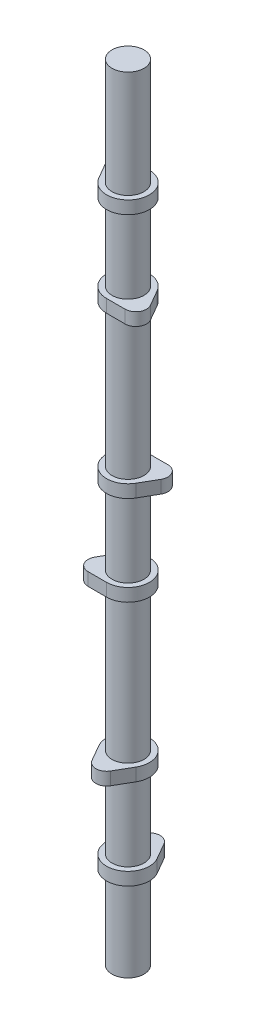
from build123d import *

# Parameters (mm, degrees)
BOSS_EXTRUDE1_DEPTH   = 7.62
LPATTERN1_COUNT       = 2
LPATTERN1_PITCH       = 53.34
BODY_MOVE_COPY1_ANGLE = 180
LPATTERN2_COUNT       = 3
LPATTERN2_PITCH       = 146.05
BODY_MOVE_COPY2_ANGLE = 120
BODY_MOVE_COPY3_ANGLE = 120
BOSS_EXTRUDE2_START   = -49.53
SKETCH2_R             = 9.5
BOSS_EXTRUDE2_DEPTH   = 466.09


with BuildPart() as part:
    # Sketch1 → Boss-Extrude1 (new body)
    with BuildSketch(Plane(origin=(0, 0, 0), x_dir=(1, 0, 0), z_dir=(0, 1, 0))):
        with BuildLine():
            Line((-5.499261314, 15.875), (-10.998522628, 6.35))
            ThreePointArc((-10.998522628, 6.35), (0, -12.7), (10.998522628, 6.35))
            Line((10.998522628, 6.35), (5.499261314, 15.875))
            ThreePointArc((5.499261314, 15.875), (0, 19.05), (-5.499261314, 15.875))
        make_face()
    extrude(amount=BOSS_EXTRUDE1_DEPTH)


with BuildPart() as lpattern1_1:
    # LPattern1: pattern copy
    add(part.part.moved(Location(Vector(0, 1, 0) * (1 * LPATTERN1_PITCH))))


with BuildPart() as lpattern1_1_1:
    # Body-Move/Copy1: moved
    add(lpattern1_1.part.rotate(Axis((0, 0, 0), (0, 1, 0)), BODY_MOVE_COPY1_ANGLE))


with BuildPart() as lpattern2_1:
    # LPattern2: pattern copy
    add(part.part.moved(Location(Vector(0, 1, 0) * (1 * LPATTERN2_PITCH))))


with BuildPart() as lpattern2_2:
    # LPattern2: pattern copy
    add(part.part.moved(Location(Vector(0, 1, 0) * (2 * LPATTERN2_PITCH))))


with BuildPart() as lpattern2_3:
    # LPattern2: pattern copy
    add(lpattern1_1_1.part.moved(Location(Vector(0, 1, 0) * (1 * LPATTERN2_PITCH))))


with BuildPart() as lpattern2_4:
    # LPattern2: pattern copy
    add(lpattern1_1_1.part.moved(Location(Vector(0, 1, 0) * (2 * LPATTERN2_PITCH))))


with BuildPart() as lpattern2_1_1:
    # Body-Move/Copy2: moved
    add(lpattern2_1.part.rotate(Axis((0, 0, 0), (0, 1, 0)), BODY_MOVE_COPY2_ANGLE))


with BuildPart() as lpattern2_3_1:
    # Body-Move/Copy2: moved
    add(lpattern2_3.part.rotate(Axis((0, 0, 0), (0, 1, 0)), BODY_MOVE_COPY2_ANGLE))


with BuildPart() as lpattern2_2_1:
    # Body-Move/Copy3: moved
    add(lpattern2_2.part.rotate(Axis((0, 0, 0), (0, -1, 0)), BODY_MOVE_COPY3_ANGLE))


with BuildPart() as lpattern2_4_1:
    # Body-Move/Copy3: moved
    add(lpattern2_4.part.rotate(Axis((0, 0, 0), (0, -1, 0)), BODY_MOVE_COPY3_ANGLE))


with BuildPart() as part_1:
    add(part.part)

    add(lpattern1_1_1.part)  # Boss-Extrude2 merges LPattern1_1

    add(lpattern2_1_1.part)  # Boss-Extrude2 merges LPattern2_1

    add(lpattern2_2_1.part)  # Boss-Extrude2 merges LPattern2_2

    add(lpattern2_3_1.part)  # Boss-Extrude2 merges LPattern2_3

    add(lpattern2_4_1.part)  # Boss-Extrude2 merges LPattern2_4
    # Sketch2 → Boss-Extrude2 (add)
    with BuildSketch(Plane(origin=(0, 0, 0), x_dir=(1, 0, 0), z_dir=(0, 1, 0)).offset(BOSS_EXTRUDE2_START)):
        Circle(SKETCH2_R)
    extrude(amount=BOSS_EXTRUDE2_DEPTH)


solid = part_1.part
